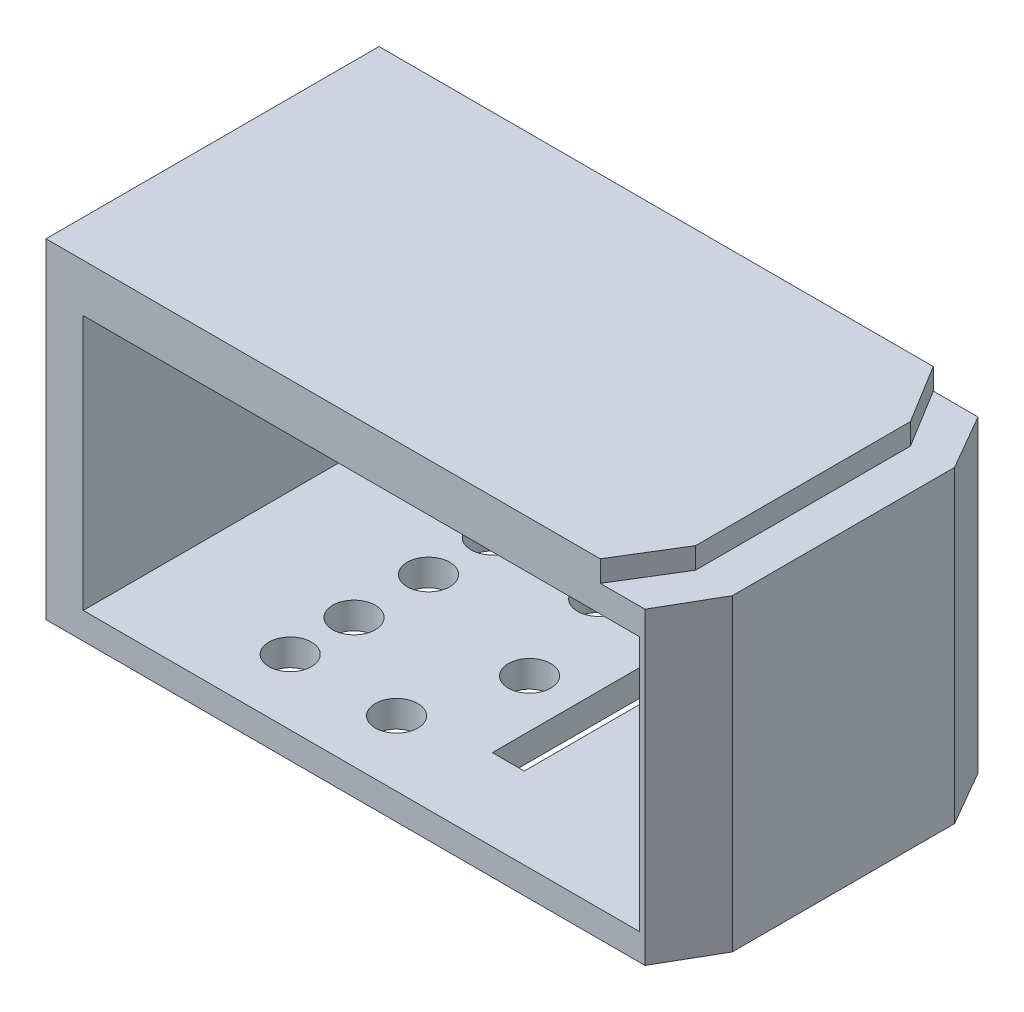
from build123d import *

# Parameters (mm, degrees)
VISTA_FRONTAL_W         = 59.3
VISTA_FRONTAL_H         = 29
VISTA_FRONTAL_W_2       = 52.3
VISTA_FRONTAL_H_2       = 24
CORPO_DO_MODULO_DEPTH   = 15.65
ESBO_O3_R               = 2.3
PADR_O_DE_ENCAIXE_DEPTH = 45.328828092
ESBO_O4_R               = 2
ESBO_O4_W               = 3
ESBO_O4_H               = 16
FUROS_INTERNOS_DEPTH    = 3.6
CAL_O_SUPERIOR_DEPTH    = 2
CORTE_START             = -0.5
FURO_COMPENSADOR_R      = 2.3
CORTE_COMPENSADOR_DEPTH = 0.5


with BuildPart() as part:
    # Vista Frontal → Corpo do Modulo (new, symmetric)
    with BuildSketch(Plane.XY):
        Rectangle(VISTA_FRONTAL_W, VISTA_FRONTAL_H)
        Rectangle(VISTA_FRONTAL_W_2, VISTA_FRONTAL_H_2, mode=Mode.SUBTRACT)
    extrude(amount=CORPO_DO_MODULO_DEPTH, both=True)

    # Esboço3 → Padrão de Encaixe (cut, through all)
    with BuildSketch(Plane(origin=(0, 14.5, 0), x_dir=(1, 0, 0), z_dir=(0, 1, 0))):
        with Locations((-29.65, 0)):
            Circle(ESBO_O3_R)
        Polygon((26.6477786, -15.65), (29.65, -10.45), (29.65, -15.65), align=None)
        Polygon((29.65, 15.65), (26.6477786, 15.65), (29.65, 10.45), align=None)
    extrude(amount=-PADR_O_DE_ENCAIXE_DEPTH, mode=Mode.SUBTRACT)

    # Esboço4 → Furos Internos (cut)
    with BuildSketch(Plane.XZ.offset(14.5)):
        with Locations(Location((0.15, 0, 0), (0, 0, 270))):
            Circle(ESBO_O4_R)
        with Locations(Location((-2.85, 9.5, 0), (0, 0, 270))):
            Circle(ESBO_O4_R)
        with Locations(Location((-12.85, 9.5, 0), (0, 0, 270))):
            Circle(ESBO_O4_R)
        with Locations(Location((-12.85, 3.5, 0), (0, 0, 270))):
            Circle(ESBO_O4_R)
        with Locations(Location((-12.85, -3.5, 0), (0, 0, 90))):
            Circle(ESBO_O4_R)
        with Locations(Location((-12.85, -9.5, 0), (0, 0, 90))):
            Circle(ESBO_O4_R)
        with Locations(Location((-2.85, -9.5, 0), (0, 0, 90))):
            Circle(ESBO_O4_R)
        with Locations((6.15, 0)):
            Rectangle(ESBO_O4_W, ESBO_O4_H)
    extrude(amount=-FUROS_INTERNOS_DEPTH, mode=Mode.SUBTRACT)

    # Extra Tampa → Calço Superior (add)
    with BuildSketch(Plane(origin=(0, 14.5, 0), x_dir=(1, 0, 0), z_dir=(0, 1, 0))):
        Polygon((-29.65, 15.65), (22.443633412, 15.65), (25.85, 10.1), (25.85, -10.1), (22.443633412, -15.65), (-29.65, -15.65), align=None)
    extrude(amount=CAL_O_SUPERIOR_DEPTH)

    # Furo Compensador → Corte compensador (cut)
    with BuildSketch(Plane.XZ.offset(-14.5).offset(CORTE_START)):
        with Locations((-29.65, 0)):
            Circle(FURO_COMPENSADOR_R)
    extrude(amount=CORTE_COMPENSADOR_DEPTH, mode=Mode.SUBTRACT)


solid = part.part
